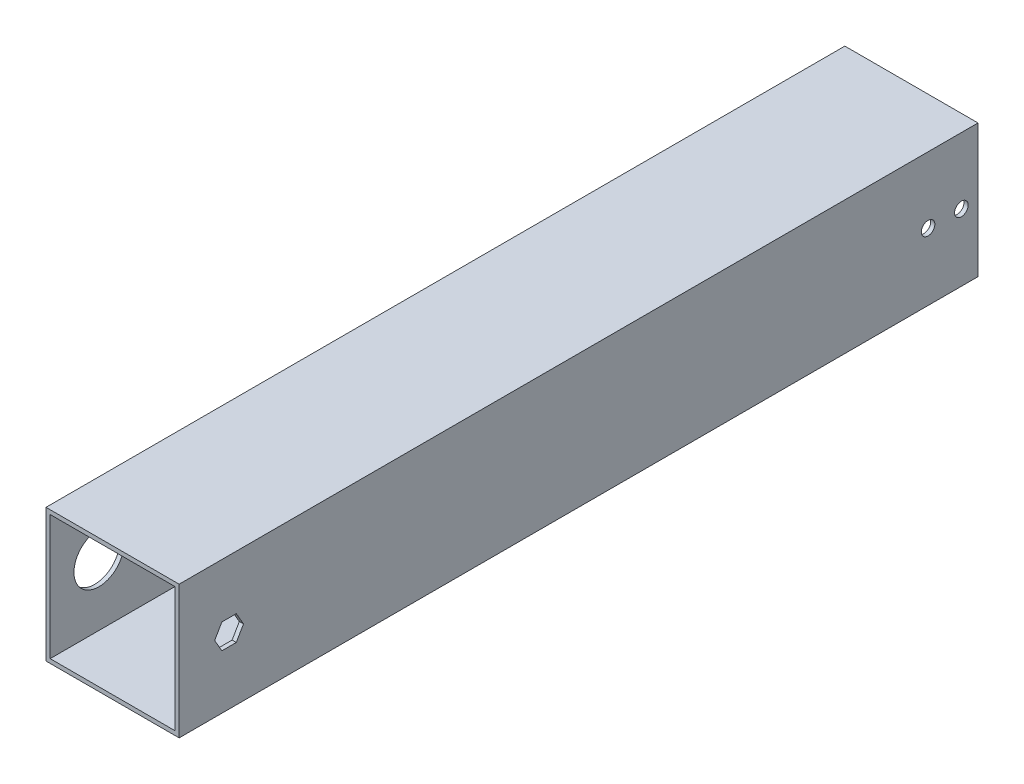
from build123d import *

# Parameters (mm, degrees)
SKETCH1_W           = 50.8
SKETCH1_H           = 50.8
SKETCH1_W_2         = 47.625
SKETCH1_H_2         = 47.625
BOSS_EXTRUDE1_DEPTH = 304.8
CUT_EXTRUDE1_DEPTH  = 304.8
SKETCH3_R           = 2.5796875
CUT_EXTRUDE2_DEPTH  = 159
SKETCH4_R           = 9.525
CUT_EXTRUDE3_DEPTH  = 3.175


with BuildPart() as part:
    # Sketch1 → Boss-Extrude1 (new body)
    with BuildSketch(Plane.XY):
        with Locations((-3.936730361, -0.161783439)):
            Rectangle(SKETCH1_W, SKETCH1_H)
        with Locations((-3.936730361, -0.161783439)):
            Rectangle(SKETCH1_W_2, SKETCH1_H_2, mode=Mode.SUBTRACT)
    extrude(amount=BOSS_EXTRUDE1_DEPTH)

    # Sketch2 → Cut-Extrude1 (cut)
    with BuildSketch(Plane(origin=(21.463269639, 0, 0), x_dir=(0, 0, -1), z_dir=(1, 0, 0))):
        Polygon((-280.250738686, -0.161783439), (-283.000369343, 4.600716561), (-288.499630657, 4.600716561), (-291.249261314, -0.161783439), (-288.499630657, -4.924283439), (-283.000369343, -4.924283439), align=None)
    extrude(amount=-CUT_EXTRUDE1_DEPTH, mode=Mode.SUBTRACT)

    # Sketch3 → Cut-Extrude2 (cut)
    with BuildSketch(Plane(origin=(21.463269639, 0, 0), x_dir=(0, 0, -1), z_dir=(1, 0, 0))):
        with Locations(Location((-6.35, 0, 0), (0, 0, 90))):
            Circle(SKETCH3_R)
        with Locations(Location((-19.05, 0, 0), (0, 0, 90))):
            Circle(SKETCH3_R)
    extrude(amount=-CUT_EXTRUDE2_DEPTH, mode=Mode.SUBTRACT)

    # Sketch4 → Cut-Extrude3 (cut)
    with BuildSketch(Plane.ZY.offset(29.336730361)):
        with Locations(Location((286.190661961, 0, 0), (0, 0, 270))):
            Circle(SKETCH4_R)
    extrude(amount=-CUT_EXTRUDE3_DEPTH, mode=Mode.SUBTRACT)


solid = part.part
